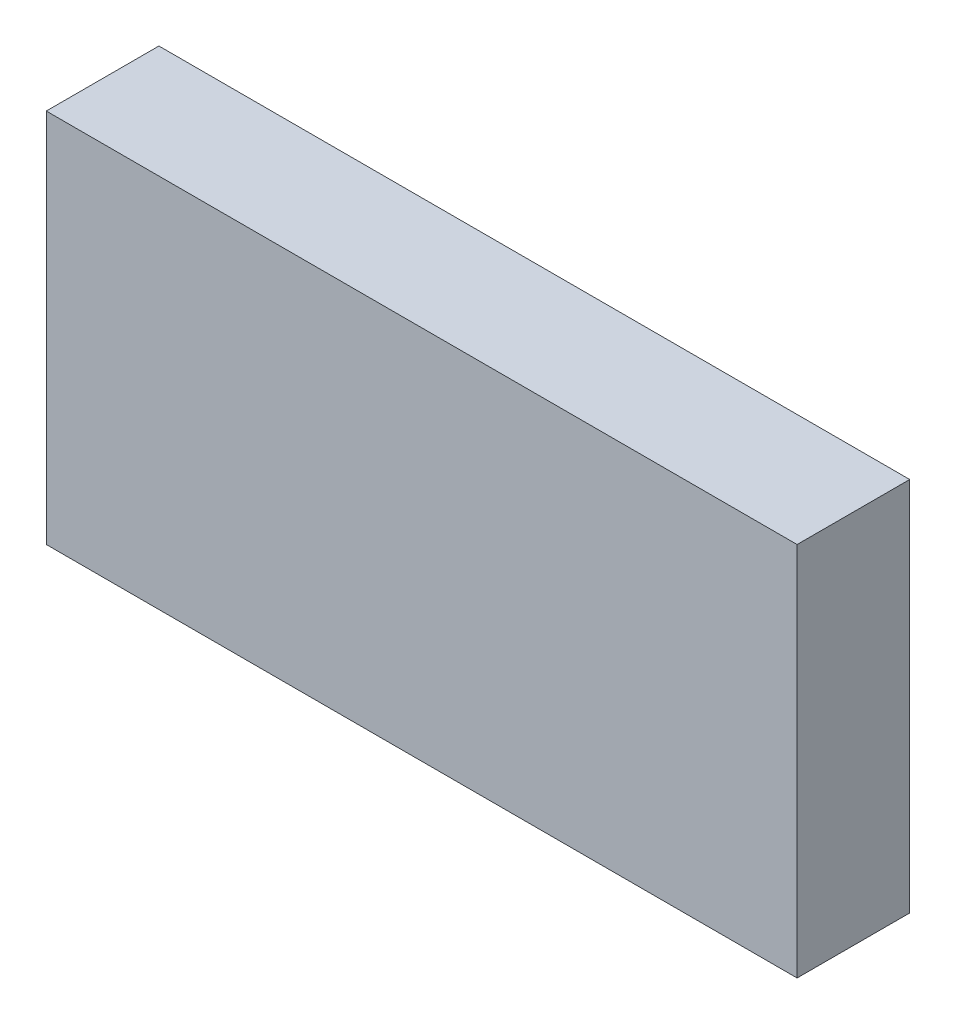
from build123d import *

# Parameters (mm, degrees)
SKETCH1_W           = 1000
SKETCH1_H           = 500
BOSS_EXTRUDE1_DEPTH = 150


with BuildPart() as part:
    # Sketch1 → Boss-Extrude1 (new body)
    with BuildSketch(Plane.XY):
        with Locations((500, 250)):
            Rectangle(SKETCH1_W, SKETCH1_H)
    extrude(amount=BOSS_EXTRUDE1_DEPTH)


solid = part.part
